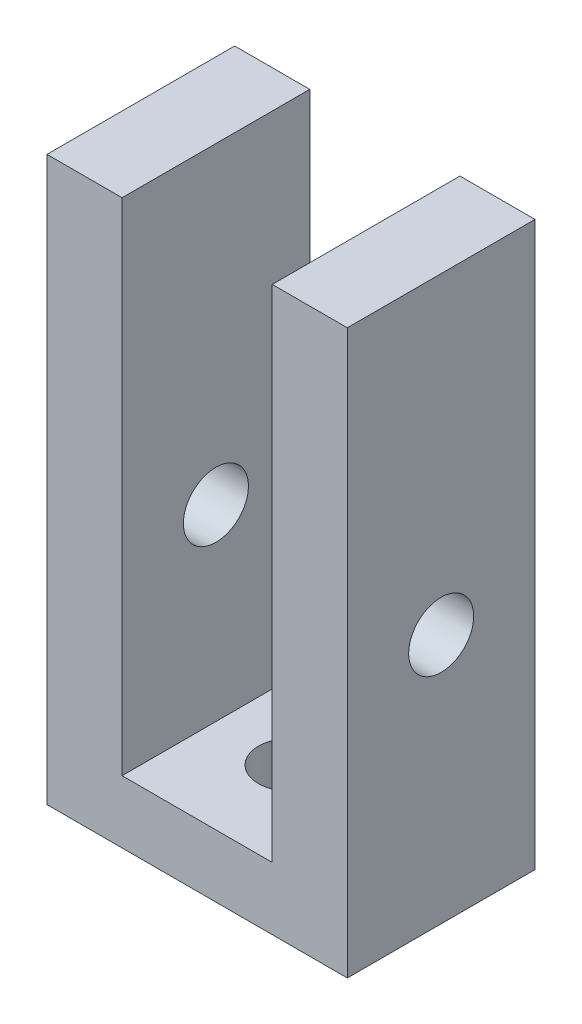
from build123d import *

# Parameters (mm, degrees)
SKETCH_5_W          = 24
SKETCH_5_H          = 15
EXTRUDE_5_DEPTH     = 5
CUT_EXTRUDE_6_REACH = 30.74
SKETCH_6_R          = 2.6
SKETCH_7_W          = 6
SKETCH_7_H          = 15
EXTRUDE_7_DEPTH     = 40
SKETCH_8_R          = 2.6
CUT_EXTRUDE_8_DEPTH = 54.16013544


with BuildPart() as part:
    # Эскиз5 → Вытянуть5 (new body)
    with BuildSketch(Plane(origin=(0, 0, 0), x_dir=(1, 0, 0), z_dir=(0, 1, 0))):
        with Locations((12, 7.5)):
            Rectangle(SKETCH_5_W, SKETCH_5_H)
    extrude(amount=EXTRUDE_5_DEPTH)

    # Эскиз6 → Вытянуть6 (cut, up to next)
    with BuildSketch(Plane(origin=(0, 5, 0), x_dir=(1, 0, 0), z_dir=(0, 1, 0)), mode=Mode.PRIVATE) as cut_extrude_6_sk1:
        with Locations(Location((12, 7.5, 0), (0, 0, 270))):
            Circle(SKETCH_6_R)
    cut_extrude_6_tool1 = extrude(cut_extrude_6_sk1.sketch, amount=-CUT_EXTRUDE_6_REACH, mode=Mode.PRIVATE) & part.part
    add(cut_extrude_6_tool1.solids().sort_by_distance((12, 5, -7.5))[0], mode=Mode.SUBTRACT)

    # Эскиз7 → Вытянуть7 (add)
    with BuildSketch(Plane(origin=(0, 5, 0), x_dir=(1, 0, 0), z_dir=(0, 1, 0))):
        with Locations((3, 7.5)):
            Rectangle(SKETCH_7_W, SKETCH_7_H)
        with Locations((21, 7.5)):
            Rectangle(SKETCH_7_W, SKETCH_7_H)
    extrude(amount=EXTRUDE_7_DEPTH)

    # Эскиз8 → Вытянуть8 (cut, through all)
    with BuildSketch(Plane.ZY):
        with Locations((-7.5, 20)):
            Circle(SKETCH_8_R)
    extrude(amount=-CUT_EXTRUDE_8_DEPTH, mode=Mode.SUBTRACT)


solid = part.part
